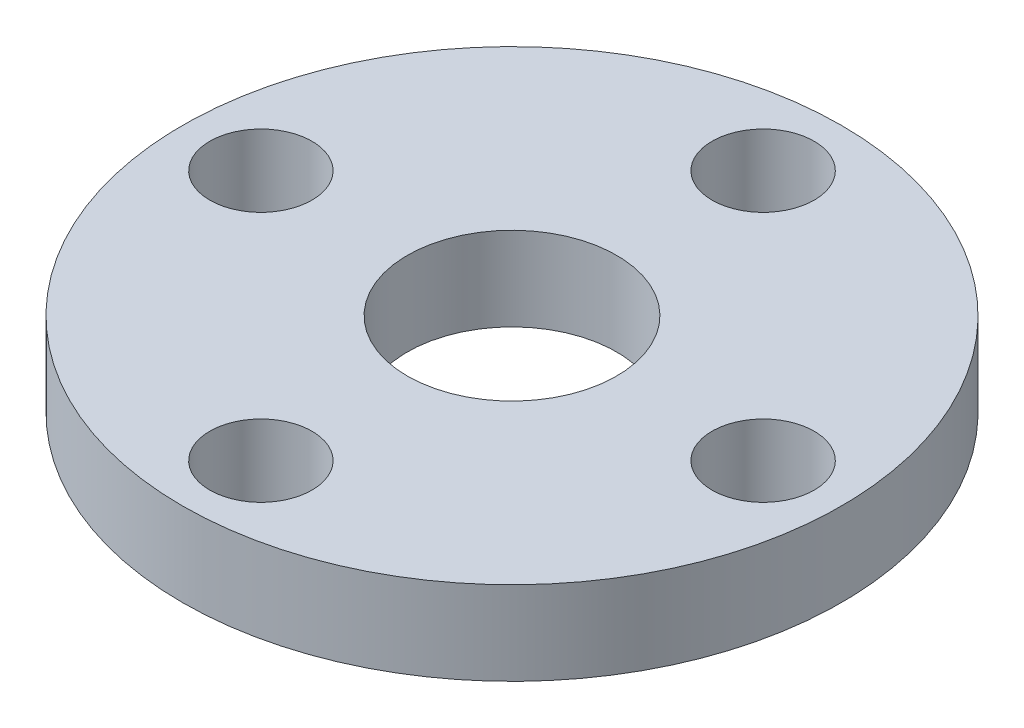
from build123d import *

# Parameters (mm, degrees)
SKETCH1_R           = 10
SKETCH1_R_2         = 3.175
SKETCH1_R_3         = 1.55
BOSS_EXTRUDE1_DEPTH = 2.54


with BuildPart() as part:
    # Sketch1 → Boss-Extrude1 (new body)
    with BuildSketch(Plane(origin=(0, 0, 0), x_dir=(1, 0, 0), z_dir=(0, 1, 0))):
        with Locations(Location((0, 0, 0), (0, 0, 270))):
            Circle(SKETCH1_R)
        with Locations(Location((0, 0, 0), (0, 0, 270))):
            Circle(SKETCH1_R_2, mode=Mode.SUBTRACT)
        with Locations(Location((0, 7.62, 0), (0, 0, 270))):
            Circle(SKETCH1_R_3, mode=Mode.SUBTRACT)
        with Locations(Location((7.62, 0, 0), (0, 0, 270))):
            Circle(SKETCH1_R_3, mode=Mode.SUBTRACT)
        with Locations(Location((0, -7.62, 0), (0, 0, 270))):
            Circle(SKETCH1_R_3, mode=Mode.SUBTRACT)
        with Locations(Location((-7.62, 0, 0), (0, 0, 270))):
            Circle(SKETCH1_R_3, mode=Mode.SUBTRACT)
    extrude(amount=BOSS_EXTRUDE1_DEPTH)


solid = part.part
